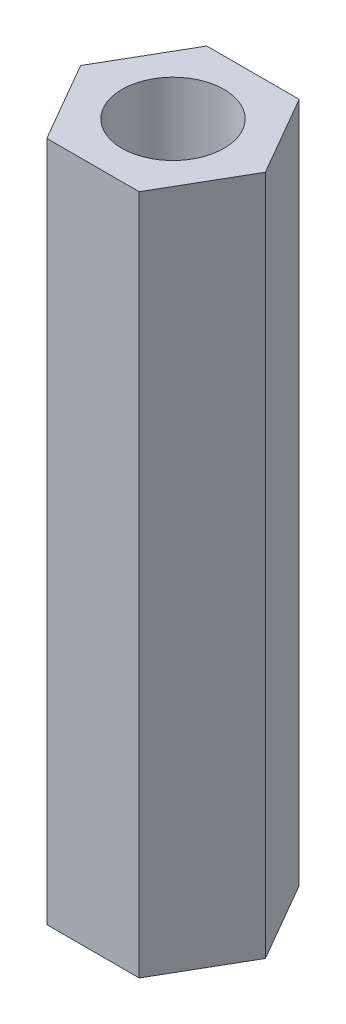
from build123d import *

# Parameters (mm, degrees)
SKETCH_2_R      = 1.5
EXTRUDE_1_DEPTH = 20


with BuildPart() as part:
    # 草图2 → 凸台-拉伸1 (new body)
    with BuildSketch(Plane(origin=(0, 0, 0), x_dir=(1, 0, 0), z_dir=(0, 1, 0))):
        Polygon((1.356773133, -2.35), (2.713546265, 0), (1.356773133, 2.35), (-1.356773133, 2.35), (-2.713546265, 0), (-1.356773133, -2.35), align=None)
        with Locations(Location((0, 0, 0), (0, 0, 270))):
            Circle(SKETCH_2_R, mode=Mode.SUBTRACT)
    extrude(amount=EXTRUDE_1_DEPTH)


solid = part.part
